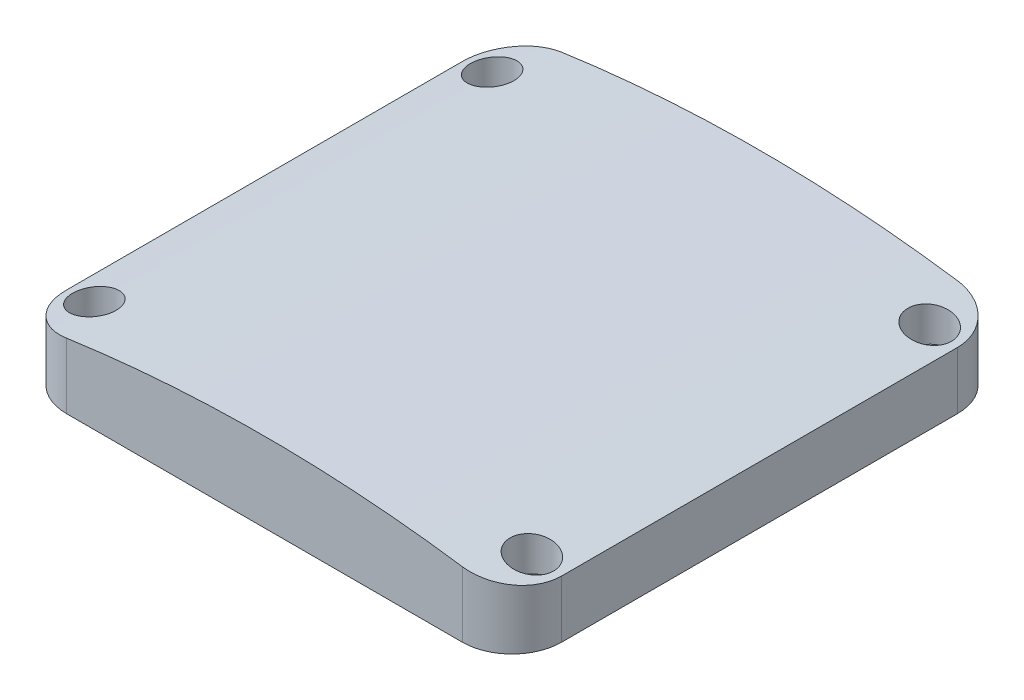
from build123d import *

# Parameters (mm, degrees)
BOSS_EXTRUDE1_DEPTH             = 31.623
FILLET1_R                       = 6.35
F_32_0_116_DIAMETER_HOLE1_D     = 2.9464
F_32_0_116_DIAMETER_HOLE1_DEPTH = 3.81
SKETCH7_R                       = 2.7813
CUT_EXTRUDE4_DEPTH              = 46.170242106


with BuildPart() as part:
    # Sketch1 → Boss-Extrude1 (new, symmetric)
    with BuildSketch(Plane.XY):
        with BuildLine():
            Line((-31.623, 174.965213317), (-31.623, 167.64))
            Line((-31.623, 167.64), (-24.003, 167.64))
            Line((-24.003, 167.64), (24.003, 167.64))
            Line((24.003, 167.64), (31.623, 167.64))
            Line((31.623, 167.64), (31.623, 174.965213317))
            ThreePointArc((31.623, 174.965213317), (0, 177.8), (-31.623, 174.965213317))
        make_face()
    extrude(amount=BOSS_EXTRUDE1_DEPTH, both=True)

    # Fillet1
    fillet1_edges = [part.edges().sort_by_distance(p)[0] for p in [
        (-31.623, 171.302606658, -31.623),
        (31.623, 171.302606658, -31.623),
        (31.623, 171.302606658, 31.623),
        (-31.623, 171.302606658, 31.623),
    ]]
    fillet(fillet1_edges, radius=FILLET1_R)

    # #32 (0.116) Diameter Hole1
    with Locations(Plane.XZ.offset(-167.64)):
        with Locations((27.94, -25.4), (-27.94, -25.4), (27.94, 25.4), (-27.94, 25.4)):
            Hole(F_32_0_116_DIAMETER_HOLE1_D / 2, depth=F_32_0_116_DIAMETER_HOLE1_DEPTH)

    # Sketch7 → Cut-Extrude4 (cut, through all)
    with BuildSketch(Plane.XZ.offset(-171.45)):
        with Locations((27.94, -25.4)):
            Circle(SKETCH7_R)
        with Locations((27.94, 25.4)):
            Circle(SKETCH7_R)
        with Locations((-27.94, 25.4)):
            Circle(SKETCH7_R)
        with Locations((-27.94, -25.4)):
            Circle(SKETCH7_R)
    extrude(amount=-CUT_EXTRUDE4_DEPTH, mode=Mode.SUBTRACT)


solid = part.part
